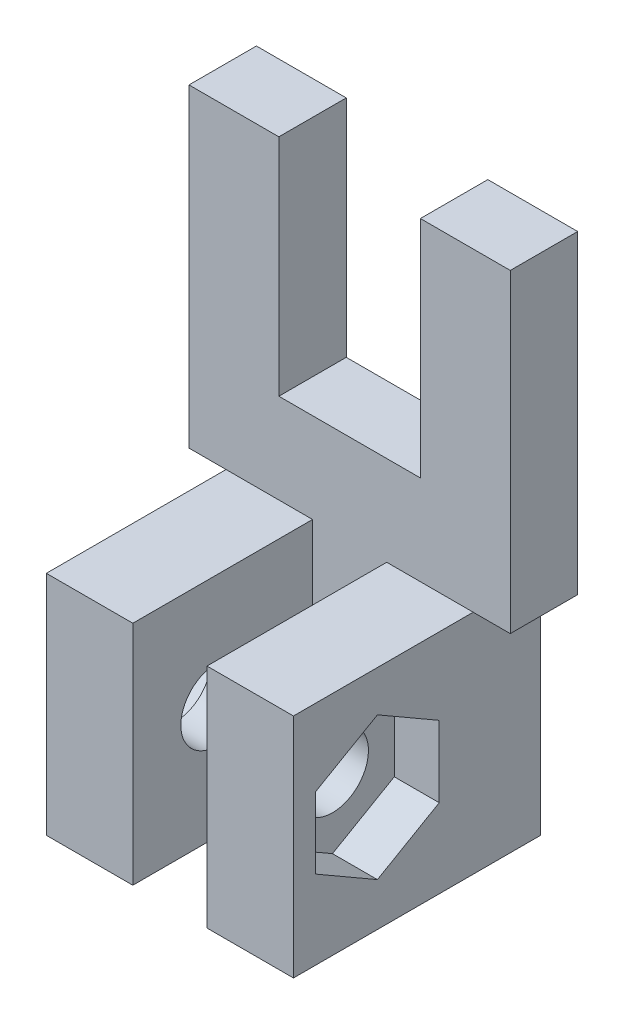
from build123d import *

# Parameters (mm, degrees)
BOSS_EXTRUDE1_DEPTH = 3
SKETCH5_W           = 3.85
SKETCH5_H           = 10.1
BOSS_EXTRUDE3_DEPTH = 8
CUT_EXTRUDE4_REACH  = 31.357
SKETCH6_R           = 1.6
SKETCH6_3_R         = 1.6
CUT_EXTRUDE5_DEPTH  = 2


with BuildPart() as part:
    # Sketch1 → Boss-Extrude1 (new body)
    with BuildSketch(Plane.XY):
        Polygon((0, 10), (0, 0), (11, 0), (11, 10), (11, 10.1), (12.65, 10.1), (12.65, 24.1), (8.65, 24.1), (8.65, 14.1), (2.35, 14.1), (2.35, 24.1), (-1.65, 24.1), (-1.65, 10.1), (0, 10.1), align=None)
    extrude(amount=BOSS_EXTRUDE1_DEPTH)

    # Sketch5 → Boss-Extrude3 (add)
    with BuildSketch(Plane.XY.offset(3)):
        with Locations((9.075, 5.05)):
            Rectangle(SKETCH5_W, SKETCH5_H)
        with Locations((1.925, 5.05)):
            Rectangle(SKETCH5_W, SKETCH5_H)
    extrude(amount=BOSS_EXTRUDE3_DEPTH)

    # Sketch6 → Cut-Extrude4 (cut, up to next)
    with BuildSketch(Plane(origin=(11, 0, 0), x_dir=(0, 0, -1), z_dir=(1, 0, 0)), mode=Mode.PRIVATE) as cut_extrude4_sk1:
        with Locations((-7.263468762, 5.1)):
            Circle(SKETCH6_R)
    cut_extrude4_tool1 = extrude(cut_extrude4_sk1.sketch, amount=-CUT_EXTRUDE4_REACH, mode=Mode.PRIVATE) & part.part
    cut_extrude4 = cut_extrude4_tool1.solids().sort_by_distance((11, 5.1, 7.263469))[0]
    add(cut_extrude4, mode=Mode.SUBTRACT)

    # Sketch6<3> → Cut-Extrude5 (cut)
    with BuildSketch(Plane(origin=(11, 0, 0), x_dir=(0, 0, -1), z_dir=(1, 0, 0))):
        Polygon((-7.263468762, 8.275426481), (-10.013468762, 6.68771324), (-10.013468762, 3.51228676), (-7.263468762, 1.924573519), (-4.513468762, 3.51228676), (-4.513468762, 6.68771324), align=None)
        with Locations((-7.263468762, 5.1)):
            Circle(SKETCH6_3_R, mode=Mode.SUBTRACT)
    cut_extrude5 = extrude(amount=-CUT_EXTRUDE5_DEPTH, mode=Mode.SUBTRACT)

    # Mirror2: Cut-Extrude4, Cut-Extrude5 across plane
    add(cut_extrude4.mirror(Plane(origin=(5.5, 0, 0), x_dir=(0, 0, 1), z_dir=(1, 0, 0))), mode=Mode.SUBTRACT)
    add(cut_extrude5.mirror(Plane(origin=(5.5, 0, 0), x_dir=(0, 0, 1), z_dir=(1, 0, 0))), mode=Mode.SUBTRACT)


solid = part.part
